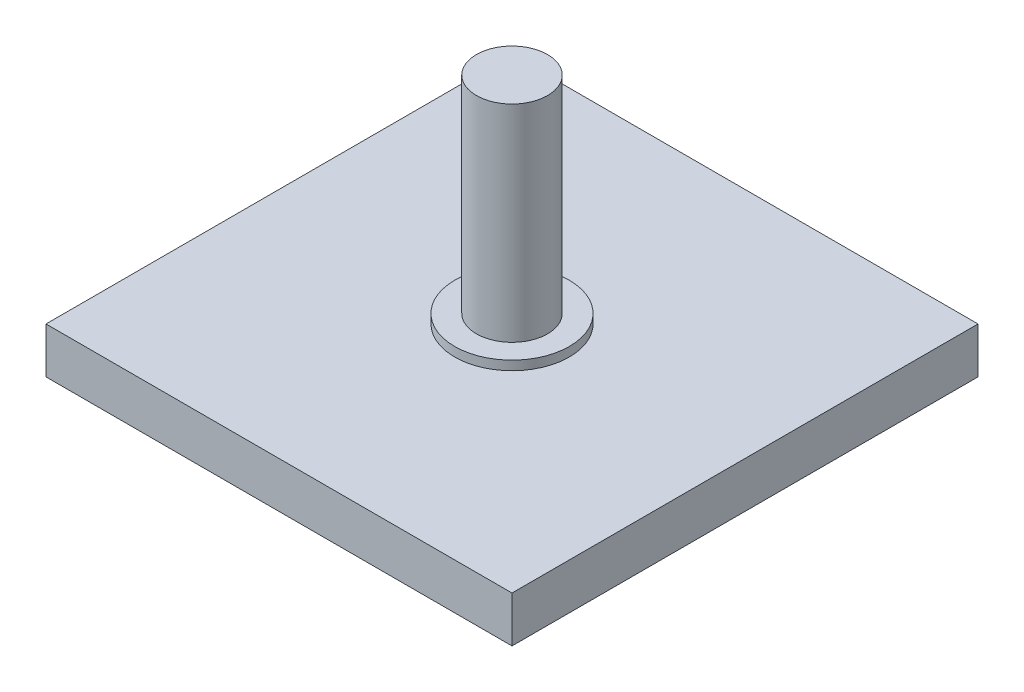
from build123d import *

# Parameters (mm, degrees)
SKETCH1_W           = 101.6
SKETCH1_H           = 101.6
BOSS_EXTRUDE1_DEPTH = 10
SKETCH2_R           = 5
CUT_EXTRUDE1_DEPTH  = 5
SKETCH3_R           = 12.5
BOSS_EXTRUDE2_DEPTH = 2
SKETCH4_R           = 7.75
BOSS_EXTRUDE3_DEPTH = 45


with BuildPart() as part:
    # Sketch1 → Boss-Extrude1 (new body)
    with BuildSketch(Plane(origin=(0, 0, 0), x_dir=(1, 0, 0), z_dir=(0, 1, 0))):
        Rectangle(SKETCH1_W, SKETCH1_H)
    extrude(amount=BOSS_EXTRUDE1_DEPTH)

    # Sketch2 → Cut-Extrude1 (cut)
    with BuildSketch(Plane(origin=(0, 0, 0), x_dir=(-1, 0, 0), z_dir=(0, -1, 0))):
        with Locations(Location((0, 0, 0), (0, 0, 90))):
            Circle(SKETCH2_R)
    extrude(amount=-CUT_EXTRUDE1_DEPTH, mode=Mode.SUBTRACT)

    # Sketch3 → Boss-Extrude2 (add)
    with BuildSketch(Plane(origin=(0, 10, 0), x_dir=(1, 0, 0), z_dir=(0, 1, 0))):
        with Locations(Location((0, 0, 0), (0, 0, 90))):
            Circle(SKETCH3_R)
    extrude(amount=BOSS_EXTRUDE2_DEPTH)

    # Sketch4 → Boss-Extrude3 (add)
    with BuildSketch(Plane(origin=(0, 12, 0), x_dir=(1, 0, 0), z_dir=(0, 1, 0))):
        with Locations(Location((0, 0, 0), (0, 0, 90))):
            Circle(SKETCH4_R)
    extrude(amount=BOSS_EXTRUDE3_DEPTH)


solid = part.part
